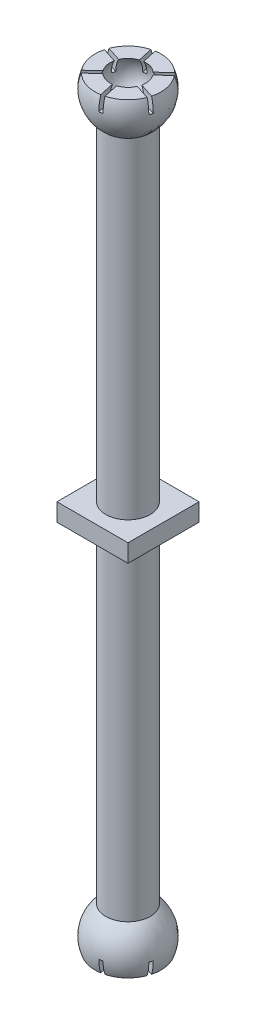
from build123d import *

# Parameters (mm, degrees)
SKETCH1_R           = 25
BOSS_EXTRUDE1_DEPTH = 413
SKETCH12_R          = 49.42250276
CUT_EXTRUDE5_DEPTH  = 883.814249998
SKETCH13_R          = 55.438586655
CUT_EXTRUDE6_DEPTH  = 883.814249998
CUT_EXTRUDE7_DEPTH  = 868.845608389
CUT_EXTRUDE8_DEPTH  = 843.900349982
SKETCH18_W          = 80
SKETCH18_H          = 80
BOSS_EXTRUDE2_DEPTH = 10


with BuildPart() as part:
    # Sketch1 → Boss-Extrude1 (new, symmetric)
    with BuildSketch(Plane(origin=(0, 0, 0), x_dir=(1, 0, 0), z_dir=(0, 1, 0))):
        with Locations(Location((0, 0, 0), (0, 0, 90))):
            Circle(SKETCH1_R)
    extrude(amount=BOSS_EXTRUDE1_DEPTH, both=True)

    # Sketch10 → Revolve4 (revolve)
    with BuildSketch(Plane(origin=(0, 413, 0), x_dir=(1, 0, 0), z_dir=(0, 1, 0))):
        with BuildLine():
            Line((0, 40), (0, -40))
            ThreePointArc((0, -40), (-40, 0), (0, 40))
        make_face()
    revolve(axis=Axis((0, 413, -40), (0, 0, 1)))

    # Sketch11 → Revolve5 (revolve)
    with BuildSketch(Plane.XZ.offset(413)):
        with BuildLine():
            Line((0, 40), (0, -40))
            ThreePointArc((0, -40), (-40, 0), (0, 40))
        make_face()
    revolve(axis=Axis((0, -413, 40), (0, 0, -1)))

    # Sketch12 → Cut-Extrude5 (cut, through all)
    with BuildSketch(Plane(origin=(0, -428, 0), x_dir=(-1, 0, 0), z_dir=(0, -1, 0))):
        Circle(SKETCH12_R)
    extrude(amount=CUT_EXTRUDE5_DEPTH, mode=Mode.SUBTRACT)

    # Sketch13 → Cut-Extrude6 (cut, through all)
    with BuildSketch(Plane(origin=(0, 428, 0), x_dir=(1, 0, 0), z_dir=(0, 1, 0))):
        Circle(SKETCH13_R)
    extrude(amount=CUT_EXTRUDE6_DEPTH, mode=Mode.SUBTRACT)

    # Sketch14 → Cut-Revolve1 (revolve, cut)
    with BuildSketch(Plane(origin=(0, 413, 0), x_dir=(1, 0, 0), z_dir=(0, 1, 0))):
        with BuildLine():
            Line((-14.413332138, -20.426841574), (14.413332138, 20.426841574))
            ThreePointArc((14.413332138, 20.426841574), (-20.426841574, 14.413332138), (-14.413332138, -20.426841574))
        make_face()
    revolve(axis=Axis((-14.413332138, 413, 20.426841574), (0.5765332855332356, 0, -0.817073662941263)), mode=Mode.SUBTRACT)

    # Sketch15 → Cut-Extrude7 (cut, through all)
    with BuildSketch(Plane(origin=(0, 413, 0), x_dir=(1, 0, 0), z_dir=(0, 1, 0))):
        with BuildLine():
            Line((-2.694041765, 2.956710837), (-40.334935268, 14.941528549))
            ThreePointArc((-40.334935268, 14.941528549), (-40.986047645, 13.049910989), (-41.548501081, 11.130064523))
            Line((-41.548501081, 11.130064523), (-3.907607578, -0.854753189))
            Line((-3.907607578, -0.854753189), (-33.107210928, -27.460314327))
            ThreePointArc((-33.107210928, -27.460314327), (-31.794578256, -28.970002967), (-30.413169164, -30.417025164))
            Line((-30.413169164, -30.417025164), (-1.213565814, -3.811464025))
            Line((-1.213565814, -3.811464025), (7.227724339, -42.401842876))
            ThreePointArc((7.227724339, -42.401842876), (9.191469389, -42.019913956), (11.135331918, -41.547089687))
            Line((11.135331918, -41.547089687), (2.694041765, -2.956710837))
            Line((2.694041765, -2.956710837), (40.334935268, -14.941528549))
            ThreePointArc((40.334935268, -14.941528549), (40.986047645, -13.049910989), (41.548501081, -11.130064523))
            Line((41.548501081, -11.130064523), (3.907607578, 0.854753189))
            Line((3.907607578, 0.854753189), (33.107210928, 27.460314327))
            ThreePointArc((33.107210928, 27.460314327), (31.794578256, 28.970002967), (30.413169164, 30.417025164))
            Line((30.413169164, 30.417025164), (1.213565814, 3.811464025))
            Line((1.213565814, 3.811464025), (-7.227724339, 42.401842876))
            ThreePointArc((-7.227724339, 42.401842876), (-9.191469389, 42.019913956), (-11.135331918, 41.547089687))
            Line((-11.135331918, 41.547089687), (-2.694041765, 2.956710837))
        make_face()
    extrude(amount=CUT_EXTRUDE7_DEPTH, mode=Mode.SUBTRACT)

    # Sketch16 → Cut-Revolve2 (revolve, cut)
    with BuildSketch(Plane(origin=(0, -413, 0), x_dir=(-1, 0, 0), z_dir=(0, -1, 0))):
        with BuildLine():
            Line((-15.560495038, -19.567089568), (15.560495038, 19.567089568))
            ThreePointArc((15.560495038, 19.567089568), (-19.567089568, 15.560495038), (-15.560495038, -19.567089568))
        make_face()
    revolve(axis=Axis((15.560495038, -413, 19.567089568), (-0.6224198015105733, 0, -0.7826835827379661)), mode=Mode.SUBTRACT)

    # Sketch17 → Cut-Extrude8 (cut, through all)
    with BuildSketch(Plane(origin=(0, -413, 0), x_dir=(-1, 0, 0), z_dir=(0, -1, 0))):
        with BuildLine():
            Line((-2.694041765, -2.956710837), (-11.135331918, -41.547089687))
            ThreePointArc((-11.135331918, -41.547089687), (-9.191469389, -42.019913956), (-7.227724339, -42.401842876))
            Line((-7.227724339, -42.401842876), (1.213565814, -3.811464025))
            Line((1.213565814, -3.811464025), (30.413169164, -30.417025164))
            ThreePointArc((30.413169164, -30.417025164), (31.794578256, -28.970002967), (33.107210928, -27.460314327))
            Line((33.107210928, -27.460314327), (3.907607578, -0.854753189))
            Line((3.907607578, -0.854753189), (41.548501081, 11.130064523))
            ThreePointArc((41.548501081, 11.130064523), (40.986047645, 13.049910989), (40.334935268, 14.941528549))
            Line((40.334935268, 14.941528549), (2.694041765, 2.956710837))
            Line((2.694041765, 2.956710837), (11.135331918, 41.547089687))
            ThreePointArc((11.135331918, 41.547089687), (9.191469389, 42.019913956), (7.227724339, 42.401842876))
            Line((7.227724339, 42.401842876), (-1.213565814, 3.811464025))
            Line((-1.213565814, 3.811464025), (-30.413169164, 30.417025164))
            ThreePointArc((-30.413169164, 30.417025164), (-31.794578256, 28.970002967), (-33.107210928, 27.460314327))
            Line((-33.107210928, 27.460314327), (-3.907607578, 0.854753189))
            Line((-3.907607578, 0.854753189), (-41.548501081, -11.130064523))
            ThreePointArc((-41.548501081, -11.130064523), (-40.986047645, -13.049910989), (-40.334935268, -14.941528549))
            Line((-40.334935268, -14.941528549), (-2.694041765, -2.956710837))
        make_face()
    extrude(amount=CUT_EXTRUDE8_DEPTH, mode=Mode.SUBTRACT)

    # Sketch18 → Boss-Extrude2 (add, symmetric)
    with BuildSketch(Plane(origin=(0, 0, 0), x_dir=(1, 0, 0), z_dir=(0, 1, 0))):
        Rectangle(SKETCH18_W, SKETCH18_H)
    extrude(amount=BOSS_EXTRUDE2_DEPTH, both=True)


solid = part.part
